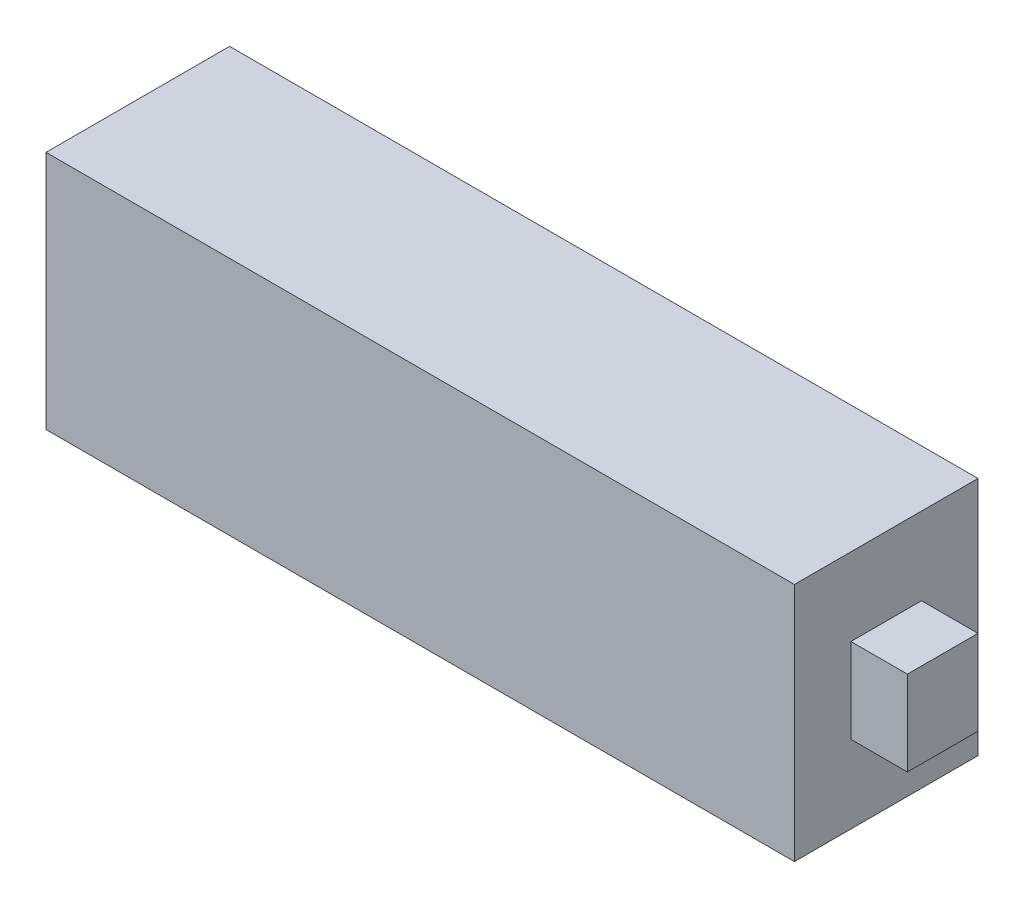
from build123d import *

# Parameters (mm, degrees)
SKETCH1_W       = 106
SKETCH1_H       = 34
PACK_2_DEPTH    = 26
SKETCH2_W       = 8
SKETCH2_H       = 12
LEAD_EXIT_DEPTH = 10


with BuildPart() as part:
    # Sketch1 → Pack 2 (new body)
    with BuildSketch(Plane.XY):
        Rectangle(SKETCH1_W, SKETCH1_H)
    extrude(amount=PACK_2_DEPTH)

    # Sketch2 → Lead_exit (add)
    with BuildSketch(Plane.XY.offset(8)):
        with Locations((57, 0)):
            Rectangle(SKETCH2_W, SKETCH2_H)
    extrude(amount=LEAD_EXIT_DEPTH)


solid = part.part
